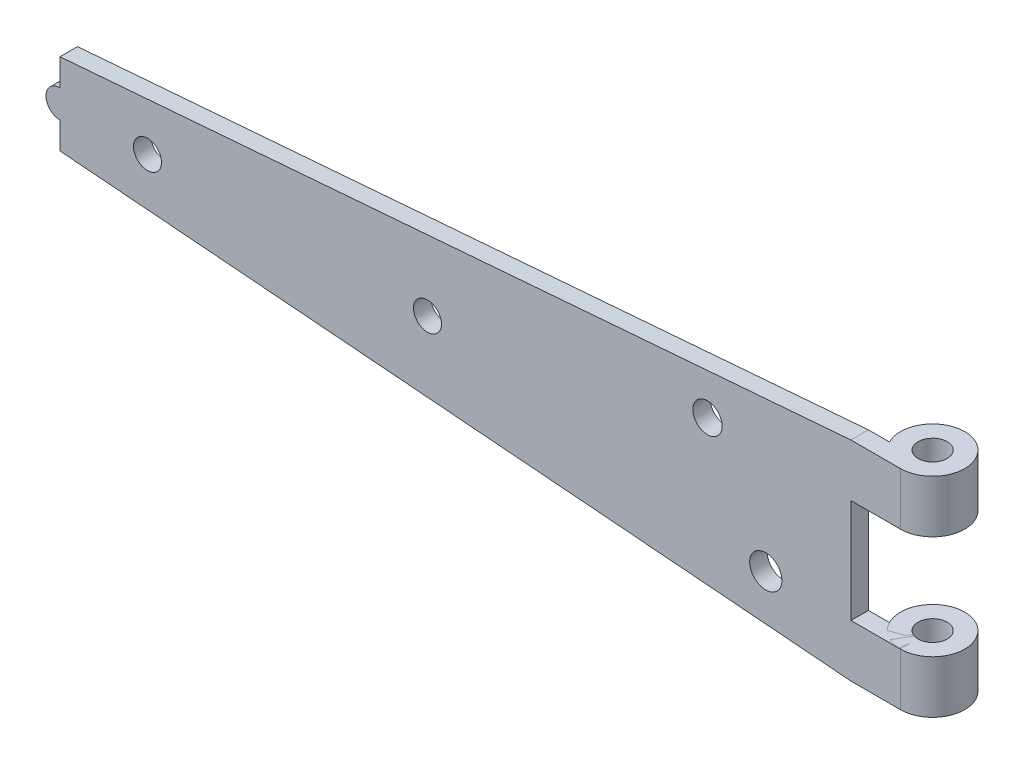
from build123d import *

# Parameters (mm, degrees)
SKETCH1_R           = 2.4
SKETCH1_R_2         = 2.515000774
SKETCH1_R_3         = 2.764002303
BOSS_EXTRUDE1_DEPTH = 3
SKETCH2_R           = 5.5
BOSS_EXTRUDE2_DEPTH = 9
BOSS_EXTRUDE3_START = 26.8
SKETCH2_2_R         = 5.5
BOSS_EXTRUDE3_DEPTH = 9
SKETCH4_R           = 2.5
CUT_EXTRUDE1_DEPTH  = 143.792296711


with BuildPart() as part:
    # Sketch1 → Boss-Extrude1 (new body)
    with BuildSketch(Plane.XY):
        with BuildLine():
            Line((0, 0), (-135.6, 10.9))
            Line((-135.6, 10.9), (-135.6, 15.5))
            ThreePointArc((-135.6, 15.5), (-138, 17.9), (-135.6, 20.3))
            Line((-135.6, 20.3), (-135.6, 24.9))
            Line((-135.6, 24.9), (0, 35.8))
            Line((0, 35.8), (8.449966918, 35.8))
            Line((8.449966918, 35.8), (8.449966918, 26.8))
            Line((8.449966918, 26.8), (0, 26.8))
            Line((0, 26.8), (0, 9))
            Line((0, 9), (8.449966918, 9))
            Line((8.449966918, 9), (8.449966918, 0))
            Line((8.449966918, 0), (0, 0))
        make_face()
        with Locations((-120.6, 17.9)):
            Circle(SKETCH1_R, mode=Mode.SUBTRACT)
        with Locations((-72.6, 17.9)):
            Circle(SKETCH1_R, mode=Mode.SUBTRACT)
        with Locations((-24.6, 26.8)):
            Circle(SKETCH1_R_2, mode=Mode.SUBTRACT)
        with Locations((-14.6, 9)):
            Circle(SKETCH1_R_3, mode=Mode.SUBTRACT)
    extrude(amount=BOSS_EXTRUDE1_DEPTH)

    # Sketch2<2> → Boss-Extrude3 (add)
    with BuildSketch(Plane(origin=(0, 0, 0), x_dir=(1, 0, 0), z_dir=(0, 1, 0)).offset(BOSS_EXTRUDE3_START)):
        with Locations(Location((8.5, 2.5, 0), (0, 0, 90))):
            Circle(SKETCH2_2_R)
    extrude(amount=BOSS_EXTRUDE3_DEPTH)


with BuildPart() as body_2:
    # Sketch2 → Boss-Extrude2 (new body)
    with BuildSketch(Plane(origin=(0, 0, 0), x_dir=(1, 0, 0), z_dir=(0, 1, 0))):
        with Locations(Location((8.5, 2.5, 0), (0, 0, 90))):
            Circle(SKETCH2_R)
    extrude(amount=BOSS_EXTRUDE2_DEPTH)


with BuildPart() as cut_extrude1_tool:
    # Sketch4 → Cut-Extrude1 (new, through all)
    with BuildSketch(Plane(origin=(0, 0, 0), x_dir=(1, 0, 0), z_dir=(0, 1, 0))):
        with Locations(Location((8.5, 2.5, 0), (0, 0, 90))):
            Circle(SKETCH4_R)
    extrude(amount=CUT_EXTRUDE1_DEPTH)


with BuildPart() as part_1:
    add(part.part)

    # Cut-Extrude1: cut by cut_extrude1_tool
    add(cut_extrude1_tool.part, mode=Mode.SUBTRACT)


with BuildPart() as body_2_1:
    add(body_2.part)

    # Cut-Extrude1: cut by cut_extrude1_tool
    add(cut_extrude1_tool.part, mode=Mode.SUBTRACT)


solid = Compound([part_1.part, body_2_1.part])
